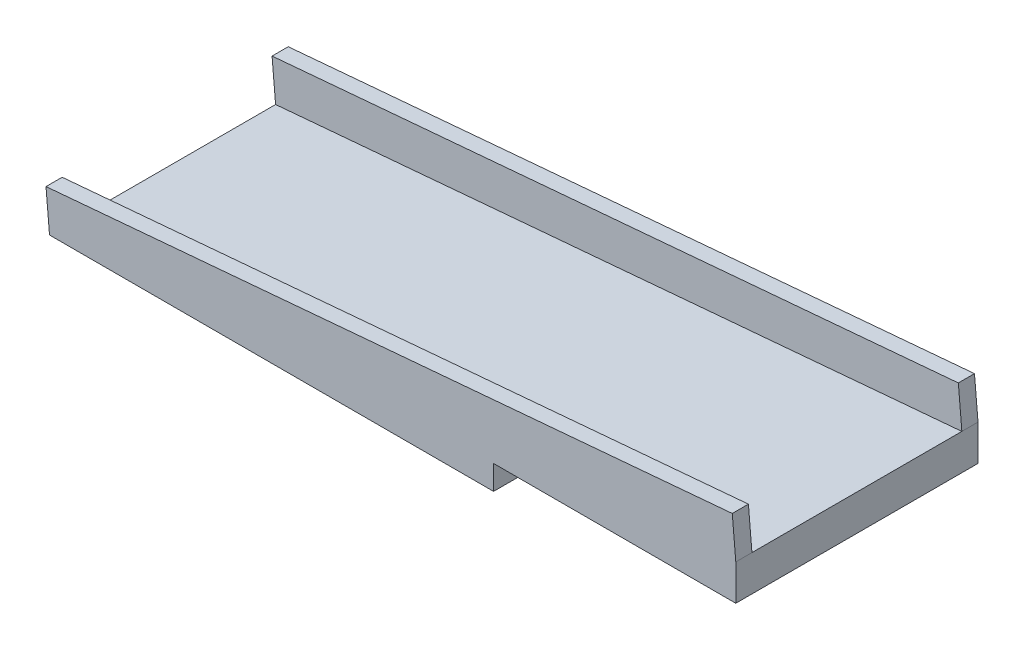
from build123d import *

# Parameters (mm, degrees)
BOSS_EXTRUDE1_DEPTH = 30
SKETCH2_W           = 85.324686191
SKETCH2_H           = 2
BOSS_EXTRUDE2_DEPTH = 5


with BuildPart() as part:
    # Sketch1 → Boss-Extrude1 (new body)
    with BuildSketch(Plane.XY):
        Polygon((41.685097369, 7.4365364), (-43.314902631, 0), (11.685097369, 0), (11.685097369, 3), (41.685097369, 3), align=None)
    extrude(amount=BOSS_EXTRUDE1_DEPTH)

    # Sketch2 → Boss-Extrude2 (add)
    with BuildSketch(Plane(origin=(-0.32902535, 3.760776954, 0), x_dir=(0.9961946980917462, 0.08715574274765156, 0), z_dir=(-0.08715574274765156, 0.9961946980917462, 0))):
        with Locations((-0.487733254, -29)):
            Rectangle(SKETCH2_W, SKETCH2_H)
        with Locations((-0.487733254, -1)):
            Rectangle(SKETCH2_W, SKETCH2_H)
    extrude(amount=BOSS_EXTRUDE2_DEPTH)


solid = part.part
